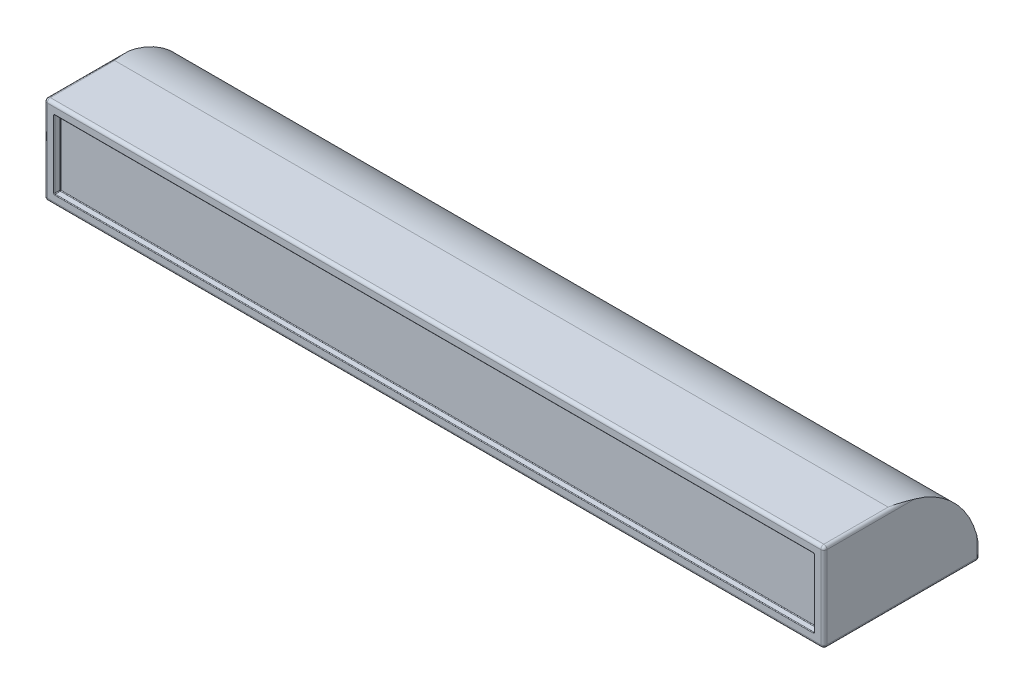
from build123d import *

# Parameters (mm, degrees)
SKETCH1_W           = 2500
SKETCH1_H           = 284
BOSS_EXTRUDE1_DEPTH = 500
FILLET1_R           = 10
SKETCH2_W           = 2436
SKETCH2_H           = 220
CUT_EXTRUDE1_DEPTH  = 20
FILLET2_R           = 2
CUT_EXTRUDE2_REACH  = 2567.279


with BuildPart() as part:
    # Sketch1 → Boss-Extrude1 (new body)
    with BuildSketch(Plane.XY):
        with Locations((1250, 142)):
            Rectangle(SKETCH1_W, SKETCH1_H)
    extrude(amount=BOSS_EXTRUDE1_DEPTH)

    # Fillet1
    fillet1_edges = [part.edges().sort_by_distance(p)[0] for p in [
        (2500, 142, 500),
        (1250, 284, 500),
        (0, 142, 500),
        (1250, 284, 0),
        (2500, 142, 0),
        (1250, 0, 0),
        (0, 142, 0),
        (0, 284, 250),
        (2500, 284, 250),
        (2500, 0, 250),
        (0, 0, 250),
        (1250, 0, 500),
    ]]
    fillet(fillet1_edges, radius=FILLET1_R)

    # Sketch2 → Cut-Extrude1 (cut)
    with BuildSketch(Plane.XY.offset(500)):
        with Locations((1250, 142)):
            Rectangle(SKETCH2_W, SKETCH2_H)
    extrude(amount=-CUT_EXTRUDE1_DEPTH, mode=Mode.SUBTRACT)

    # Fillet2
    fillet2_edges = [part.edges().sort_by_distance(p)[0] for p in [
        (2468, 142, 480),
        (2468, 252, 490),
        (1250, 32, 480),
        (2468, 32, 490),
        (32, 142, 480),
        (32, 32, 490),
        (1250, 252, 480),
        (32, 252, 490),
        (2468, 142, 500),
        (1250, 252, 500),
        (32, 142, 500),
        (1250, 32, 500),
    ]]
    fillet(fillet2_edges, radius=FILLET2_R)

    # Cut-Extrude2: up to this face of the body (flat: up to its plane)
    cut_extrude2_end = Plane(part.part.faces().sort_by_distance((2500, 142, 250))[0])
    # Sketch3 → Cut-Extrude2 (cut, up to the picked face)
    with BuildSketch(Plane.ZY, mode=Mode.PRIVATE) as cut_extrude2_sk1:
        with BuildLine():
            Line((284, 284), (0, 284))
            Line((0, 284), (0, 0))
            ThreePointArc((0, 0), (83.181674143, 200.818325857), (284, 284))
        make_face()
    cut_extrude2_tool1 = split(extrude(cut_extrude2_sk1.sketch, amount=-CUT_EXTRUDE2_REACH, mode=Mode.PRIVATE), bisect_by=cut_extrude2_end, keep=Keep.BOTH, mode=Mode.PRIVATE)
    add(cut_extrude2_tool1.solids().sort_by(Axis((0, 220.563505, 63.436495), (1, 0, 0)))[0], mode=Mode.SUBTRACT)


solid = part.part
